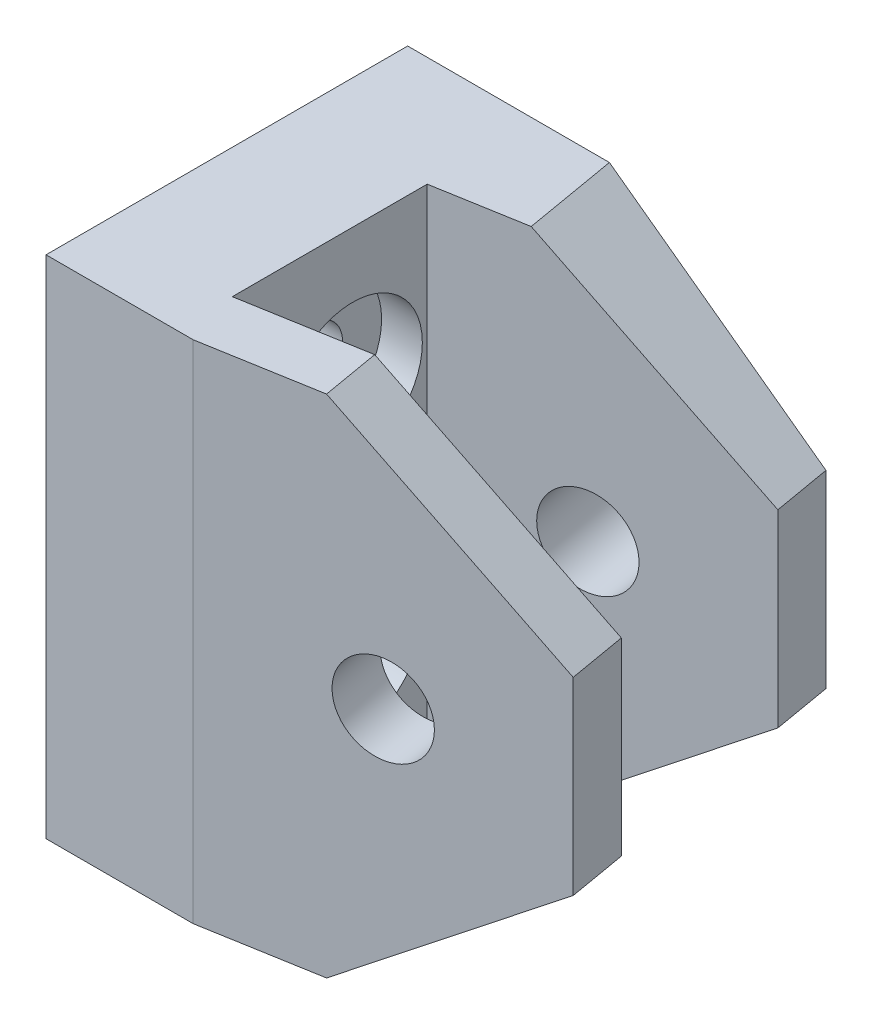
from build123d import *

# Parameters (mm, degrees)
BOSS_EXTRUDE1_DEPTH                     = 54.37886
CUT_EXTRUDE1_DEPTH                      = 87.700652431
CUT_EXTRUDE1_DEPTH_BACK                 = 87.700652431
SKETCH2_R                               = 4.7625
CBORE_FOR_M6_HEX_HEAD_BOLT1_D           = 6.6
CBORE_FOR_M6_HEX_HEAD_BOLT1_DEPTH       = 14.019159957
CBORE_FOR_M6_HEX_HEAD_BOLT1_CBORE_D     = 15
CBORE_FOR_M6_HEX_HEAD_BOLT1_CBORE_DEPTH = 4.38
CBORE_FOR_M6_HEX_HEAD_BOLT1_TIP         = 1.982840043


with BuildPart() as part:
    # Sketch1 → Boss-Extrude1 (new body)
    with BuildSketch(Plane(origin=(0, 0, 0), x_dir=(1, 0, 0), z_dir=(0, 1, 0))):
        Polygon((15.630864679, -74.497263655), (15.630864679, -35.611217769), (60.611215954, -35.611217769), (61.693150972, -41.86836701), (29.545852981, -47.427014582), (29.545852981, -68.383645943), (65.211603651, -62.21661634), (66.293538669, -68.47376558), (31.457873152, -74.497263655), align=None)
    extrude(amount=BOSS_EXTRUDE1_DEPTH)

    # Sketch2 → Cut-Extrude1 (cut, two sides: drawn at the far end of the back side and taken through both)
    with BuildSketch(Plane(origin=(13.420740042, 0, 77.616097039), x_dir=(0.9853778331324855, 0, -0.17038346742312627), z_dir=(0.17038346742312627, 0, 0.9853778331324856)).offset(-CUT_EXTRUDE1_DEPTH_BACK)):
        with Locations((35.981087332, 27.18943)):
            Circle(SKETCH2_R)
        Polygon((30.711163119, 0), (53.657385878, 17.02943), (53.657385878, 0), align=None)
        Polygon((53.657385878, 37.34943), (30.711163119, 54.37886), (53.657385878, 54.37886), align=None)
    extrude(amount=CUT_EXTRUDE1_DEPTH + CUT_EXTRUDE1_DEPTH_BACK, mode=Mode.SUBTRACT)

    # CBORE for M6 Hex Head Bolt1
    with Locations(Plane(origin=(29.545852981, 0, 0), x_dir=(0, 0, -1), z_dir=(1, 0, 0))):
        with Locations((-55.447263655, 14.48943), (-55.447263655, 39.88943)):
            CounterBoreHole(CBORE_FOR_M6_HEX_HEAD_BOLT1_D / 2, CBORE_FOR_M6_HEX_HEAD_BOLT1_CBORE_D / 2, CBORE_FOR_M6_HEX_HEAD_BOLT1_CBORE_DEPTH, depth=CBORE_FOR_M6_HEX_HEAD_BOLT1_DEPTH)
            with Locations((0, 0, -(CBORE_FOR_M6_HEX_HEAD_BOLT1_DEPTH + CBORE_FOR_M6_HEX_HEAD_BOLT1_TIP / 2))):  # 118° drill point
                Cone(0, CBORE_FOR_M6_HEX_HEAD_BOLT1_D / 2, CBORE_FOR_M6_HEX_HEAD_BOLT1_TIP, mode=Mode.SUBTRACT)


solid = part.part
